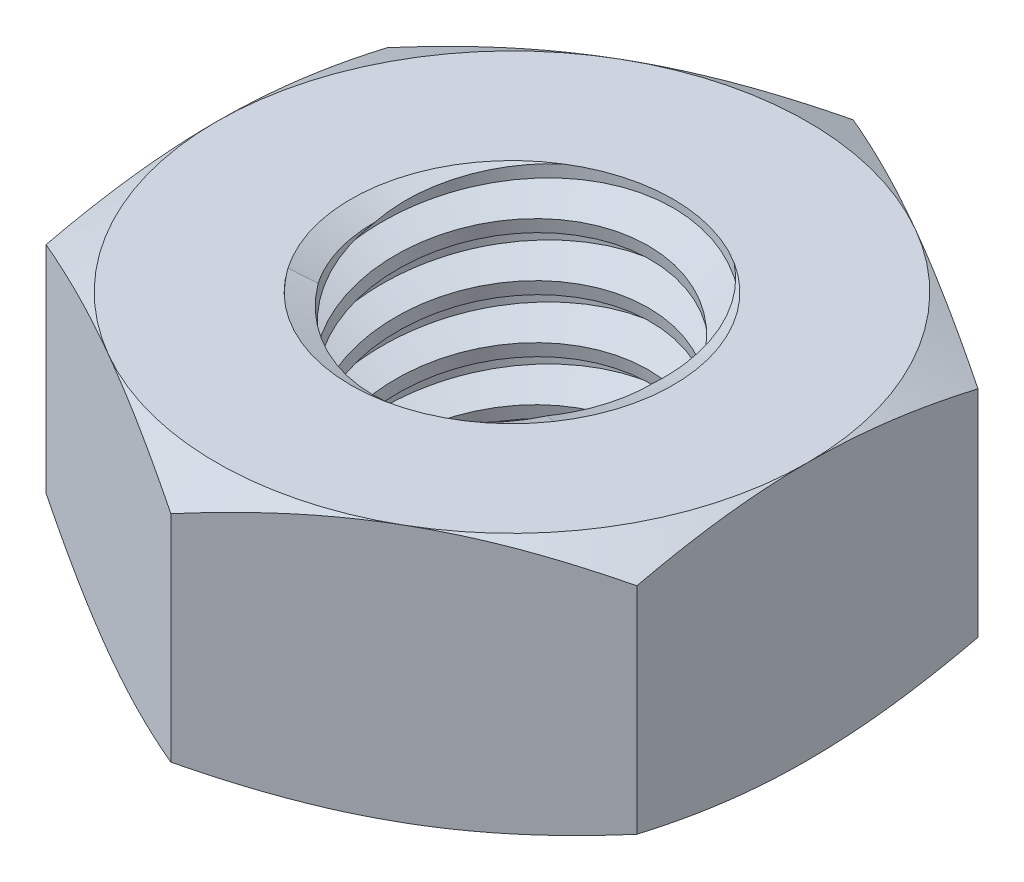
from build123d import *

# Parameters (mm, degrees)
EXTRUDE1_DEPTH       = 1.2
SKETCH2_W            = 1.5
SKETCH2_H            = 2.4
LPATTERN1_COUNT      = 5
LPATTERN1_PITCH      = 0.5
LPATTERN1_COUNT_DIR2 = 2
LPATTERN1_PITCH_DIR2 = 0.5


with BuildPart() as part:
    # Sketch1 → Extrude1 (new, symmetric)
    with BuildSketch(Plane(origin=(0, 0, 0), x_dir=(1, 0, 0), z_dir=(0, 1, 0))):
        Polygon((0, 3.175426481), (-2.75, 1.58771324), (-2.75, -1.58771324), (0, -3.175426481), (2.75, -1.58771324), (2.75, 1.58771324), align=None)
    extrude(amount=EXTRUDE1_DEPTH, both=True)

    # Sketch4 → Cut-Revolve2 (revolve, cut)
    with BuildSketch(Plane(origin=(0, 0, 0), x_dir=(0, 0, -1), z_dir=(1, 0, 0))):
        Polygon((0, 1.2), (1.5, 1.2), (1.269011592, 1.092288336), (1.269011592, -1.092288336), (1.5, -1.2), (0, -1.2), align=None)
    revolve(axis=Axis((0, 1.2, 0), (0, 1, 0)), mode=Mode.SUBTRACT)


with BuildPart() as body_2:
    # Sketch2 → Revolve1 (revolve)
    with BuildSketch(Plane(origin=(0, 0, 0), x_dir=(0, 0, -1), z_dir=(1, 0, 0))):
        with Locations((0.75, 0)):
            Rectangle(SKETCH2_W, SKETCH2_H)
    revolve(axis=Axis((0, -2.7, 0), (0, 1, 0)))

    # Sketch3 → Cut-Revolve1 (revolve, cut)
    with BuildSketch(Plane(origin=(0, 0, 0), x_dir=(0, 0, -1), z_dir=(1, 0, 0))):
        Polygon((1.510274937, 1.13835038), (1.582199494, 0.706803038), (1.289561466, 0.816435308), (1.269011592, 0.939734548), align=None)
    cut_revolve1 = revolve(axis=Axis((0, 1.2, 0.089188249), (0, -0.9863939238321439, -0.1643989873053571)), mode=Mode.SUBTRACT)

    # LPattern1: Cut-Revolve1 5 × 2
    with Locations(*[Vector(0, -1, 0) * (i * LPATTERN1_PITCH) + Vector(0, 1, 0) * (j * LPATTERN1_PITCH_DIR2) for i in range(LPATTERN1_COUNT) for j in range(LPATTERN1_COUNT_DIR2) if (i, j) != (0, 0)]):
        add(cut_revolve1, mode=Mode.SUBTRACT)


with BuildPart() as part_1:
    add(part.part)

    # Combine1: cut body 2
    add(body_2.part, mode=Mode.SUBTRACT)

    # Sketch5 → Cut-Revolve3 (revolve, cut)
    with BuildSketch(Plane(origin=(0, 0, 0), x_dir=(0, 0, -1), z_dir=(1, 0, 0))):
        Polygon((0, -1.2), (2.75, -1.2), (3.175426481, -1.001620374), (3.175426481, 1.001620374), (2.75, 1.2), (0, 1.2), (0, 2.47), (4.445426481, 2.47), (4.445426481, -2.47), (0, -2.47), align=None)
    revolve(axis=Axis((0, -1.2, 0), (0, 1, 0)), mode=Mode.SUBTRACT)


solid = part_1.part
